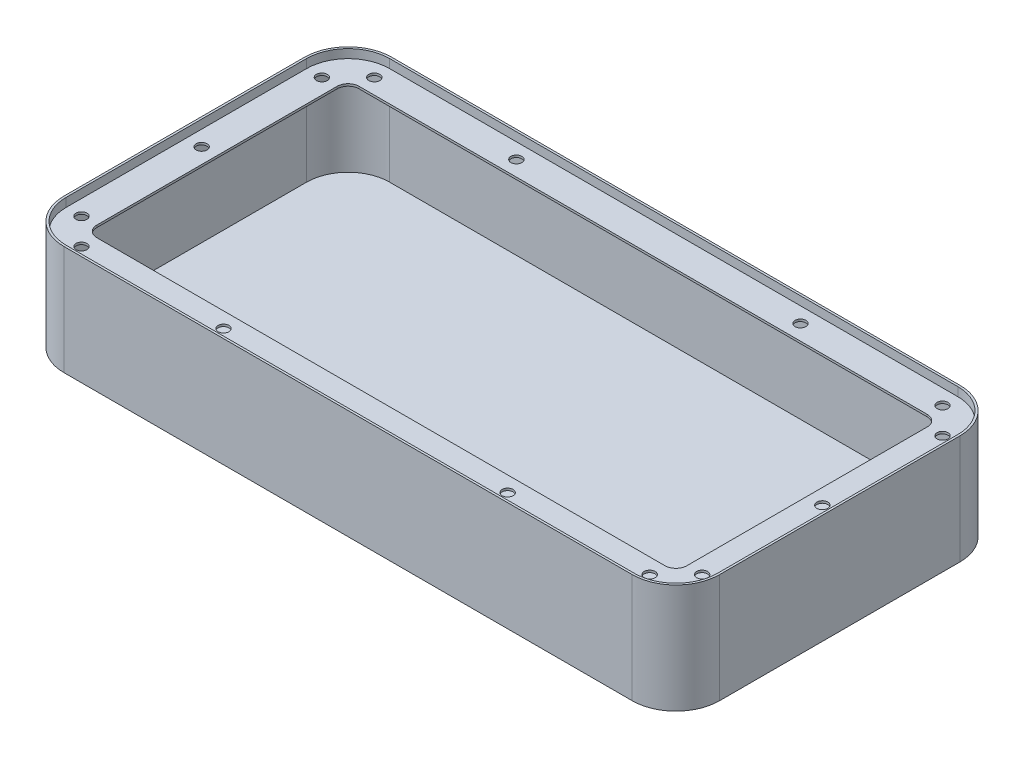
from build123d import *

# Parameters (mm, degrees)
BOSS_EXTRUDE1_DEPTH       = 50
SHELL1_T                  = -1
BOSS_EXTRUDE3_START       = 5
BOSS_EXTRUDE3_DEPTH       = 1
F_5_0MM_DOWEL_HOLE2_D     = 5
F_5_0MM_DOWEL_HOLE2_DEPTH = 1
F_5_0MM_DOWEL_HOLE3_D     = 5
F_5_0MM_DOWEL_HOLE3_DEPTH = 1


with BuildPart() as part:
    # Sketch1 → Boss-Extrude1 (new body)
    with BuildSketch(Plane(origin=(0, 0, 0), x_dir=(1, 0, 0), z_dir=(0, 1, 0))):
        with BuildLine():
            Line((-130, -75), (130, -75))
            ThreePointArc((130, -75), (144.142135624, -69.142135624), (150, -55))
            Line((150, -55), (150, 55))
            ThreePointArc((150, 55), (144.142135624, 69.142135624), (130, 75))
            Line((130, 75), (-130, 75))
            ThreePointArc((-130, 75), (-144.142135624, 69.142135624), (-150, 55))
            Line((-150, 55), (-150, -55))
            ThreePointArc((-150, -55), (-144.142135624, -69.142135624), (-130, -75))
        make_face()
    extrude(amount=BOSS_EXTRUDE1_DEPTH)

    # Shell1
    shell1_openings = [part.faces().sort_by_distance(p)[0] for p in [
        (0, 50, 0),
    ]]
    offset(amount=SHELL1_T, openings=shell1_openings, kind=Kind.INTERSECTION)

    # Sketch3 → Boss-Extrude3 (add)
    with BuildSketch(Plane(origin=(0, 50, 0), x_dir=(-1, 0, 0), z_dir=(0, -1, 0)).offset(BOSS_EXTRUDE3_START)):
        with BuildLine():
            Line((130, 75), (-130, 75))
            ThreePointArc((-130, 75), (-144.142135624, 69.142135624), (-150, 55))
            Line((-150, 55), (-150, -55))
            ThreePointArc((-150, -55), (-144.142135624, -69.142135624), (-130, -75))
            Line((-130, -75), (130, -75))
            ThreePointArc((130, -75), (144.142135624, -69.142135624), (150, -55))
            Line((150, -55), (150, 55))
            ThreePointArc((150, 55), (144.142135624, 69.142135624), (130, 75))
        make_face()
        with BuildLine():
            Line((130, -60), (-130, -60))
            ThreePointArc((-130, -60), (-133.535533906, -58.535533906), (-135, -55))
            Line((-135, -55), (-135, 55))
            ThreePointArc((-135, 55), (-133.535533906, 58.535533906), (-130, 60))
            Line((-130, 60), (130, 60))
            ThreePointArc((130, 60), (133.535533906, 58.535533906), (135, 55))
            Line((135, 55), (135, -55))
            ThreePointArc((135, -55), (133.535533906, -58.535533906), (130, -60))
        make_face(mode=Mode.SUBTRACT)
    extrude(amount=-BOSS_EXTRUDE3_DEPTH)

    # Ø5.0mm Dowel Hole2
    with Locations(Plane(origin=(0, 46, 0), x_dir=(1, 0, 0), z_dir=(0, 1, 0))):
        with Locations((-65, 67), (65, 67), (142, 0), (-142, 0), (-65, -67), (65, -67)):
            Hole(F_5_0MM_DOWEL_HOLE2_D / 2, depth=F_5_0MM_DOWEL_HOLE2_DEPTH)

    # Ø5.0mm Dowel Hole3
    with Locations(Plane(origin=(0, 46, 0), x_dir=(1, 0, 0), z_dir=(0, 1, 0))):
        with Locations((-130, 67), (-142, 55), (-142, -55), (-130, -67), (130, -67), (142, -55), (142, 55), (130, 67)):
            Hole(F_5_0MM_DOWEL_HOLE3_D / 2, depth=F_5_0MM_DOWEL_HOLE3_DEPTH)


solid = part.part
